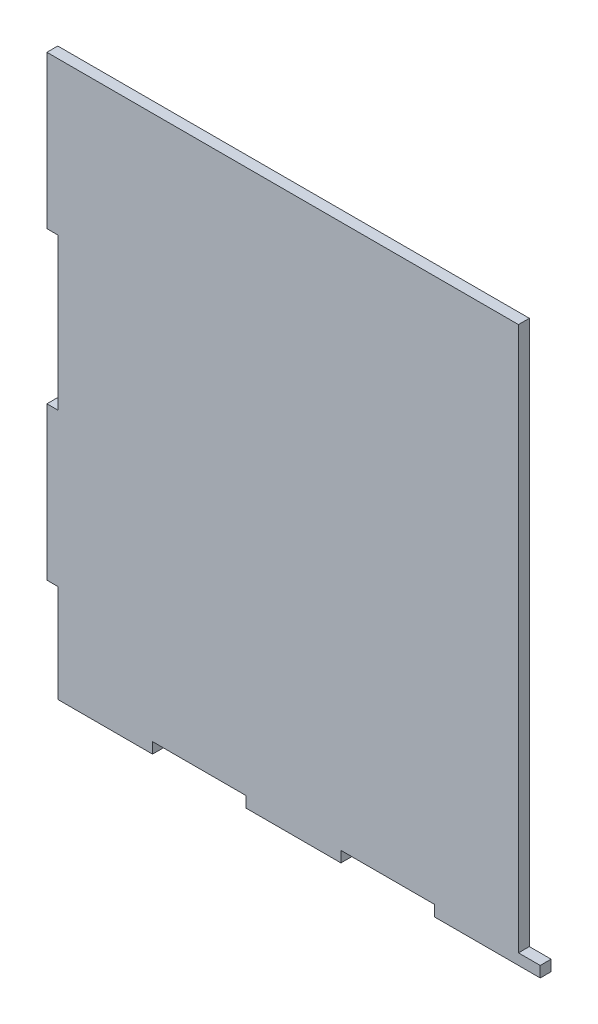
from build123d import *

# Parameters (mm, degrees)
BOSS_EXTRUDE1_DEPTH = 3


with BuildPart() as part:
    # Sketch1 → Boss-Extrude1 (new body)
    with BuildSketch(Plane.XY):
        Polygon((65.741444867, -77.144486692), (68.741444867, -77.144486692), (68.741444867, -74.144486692), (62.741444867, -74.144486692), (62.741444867, 75.855513308), (-67.258555133, 75.855513308), (-67.258555133, 33.748370448), (-64.258555133, 33.748370448), (-64.258555133, -8.058772412), (-67.258555133, -8.058772412), (-67.258555133, -50.165915272), (-64.258555133, -50.165915272), (-64.258555133, -77.144486692), (-38.138555133, -77.144486692), (-38.138555133, -74.144486692), (-12.318555133, -74.144486692), (-12.318555133, -77.144486692), (13.801444867, -77.144486692), (13.801444867, -74.144486692), (39.621444867, -74.144486692), (39.621444867, -77.144486692), align=None)
    extrude(amount=BOSS_EXTRUDE1_DEPTH)


solid = part.part
